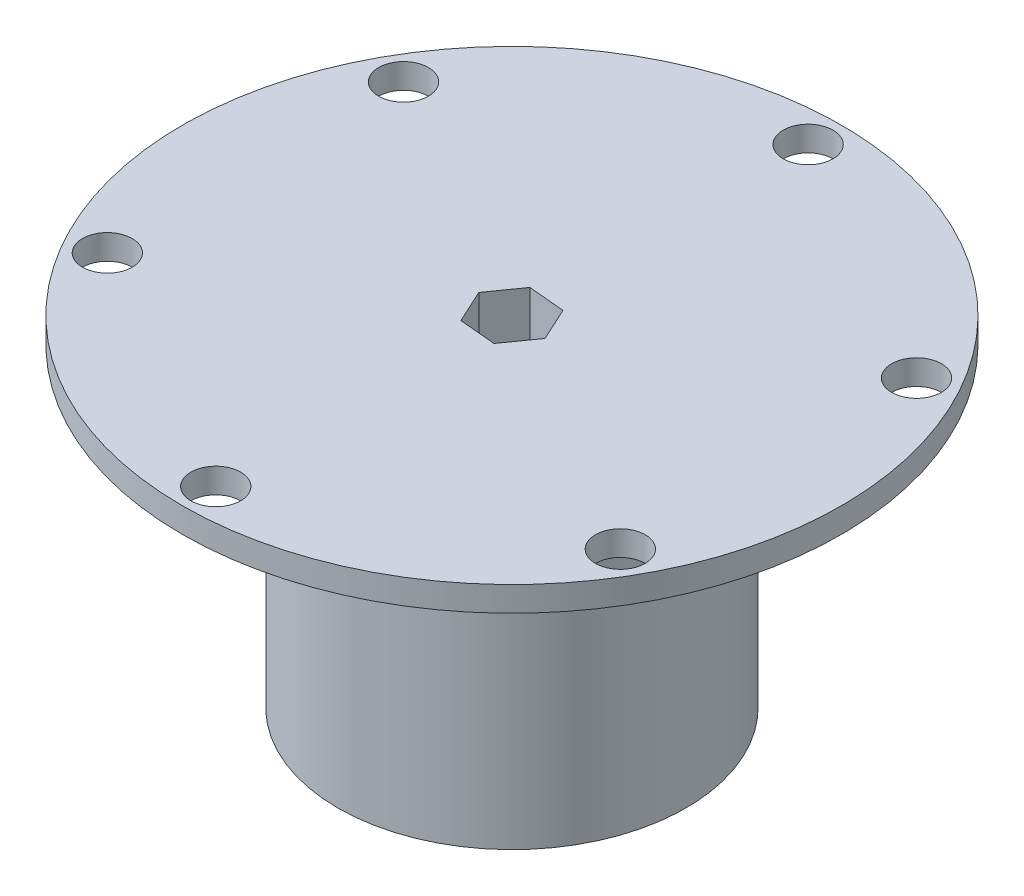
from build123d import *

# Parameters (mm, degrees)
SKETCH1_R           = 14
BOSS_EXTRUDE1_DEPTH = 25.3
SKETCH2_R           = 26.5
BOSS_EXTRUDE2_DEPTH = 2
SKETCH3_R           = 2
CUT_EXTRUDE1_DEPTH  = 32


with BuildPart() as part:
    # Sketch1 → Boss-Extrude1 (new body)
    with BuildSketch(Plane(origin=(0, 0, 0), x_dir=(1, 0, 0), z_dir=(0, 1, 0))):
        with Locations(Location((0, 0, 0), (0, 0, 270))):
            Circle(SKETCH1_R)
    extrude(amount=BOSS_EXTRUDE1_DEPTH)

    # Sketch2 → Boss-Extrude2 (add)
    with BuildSketch(Plane(origin=(0, 25.3, 0), x_dir=(1, 0, 0), z_dir=(0, 1, 0))):
        with Locations(Location((0, 0, 0), (0, 0, 270))):
            Circle(SKETCH2_R)
    extrude(amount=BOSS_EXTRUDE2_DEPTH)

    # Sketch3 → Cut-Extrude1 (cut)
    with BuildSketch(Plane(origin=(0, 27.3, 0), x_dir=(1, 0, 0), z_dir=(0, 1, 0))):
        with Locations(Location((0, 23.815, 0), (0, 0, 270))):
            Circle(SKETCH3_R)
        with Locations(Location((20.624394991, 11.9075, 0), (0, 0, 270))):
            Circle(SKETCH3_R)
        with Locations(Location((20.624394991, -11.9075, 0), (0, 0, 270))):
            Circle(SKETCH3_R)
        with Locations(Location((0, -23.815, 0), (0, 0, 270))):
            Circle(SKETCH3_R)
        with Locations(Location((-20.624394991, -11.9075, 0), (0, 0, 270))):
            Circle(SKETCH3_R)
        with Locations(Location((-20.624394991, 11.9075, 0), (0, 0, 270))):
            Circle(SKETCH3_R)
        Polygon((1.234520104, -2.673192869), (2.932312985, -0.267470663), (1.697792881, 2.405722206), (-1.234520104, 2.673192869), (-2.932312985, 0.267470663), (-1.697792881, -2.405722206), align=None)
    extrude(amount=-CUT_EXTRUDE1_DEPTH, mode=Mode.SUBTRACT)


solid = part.part
